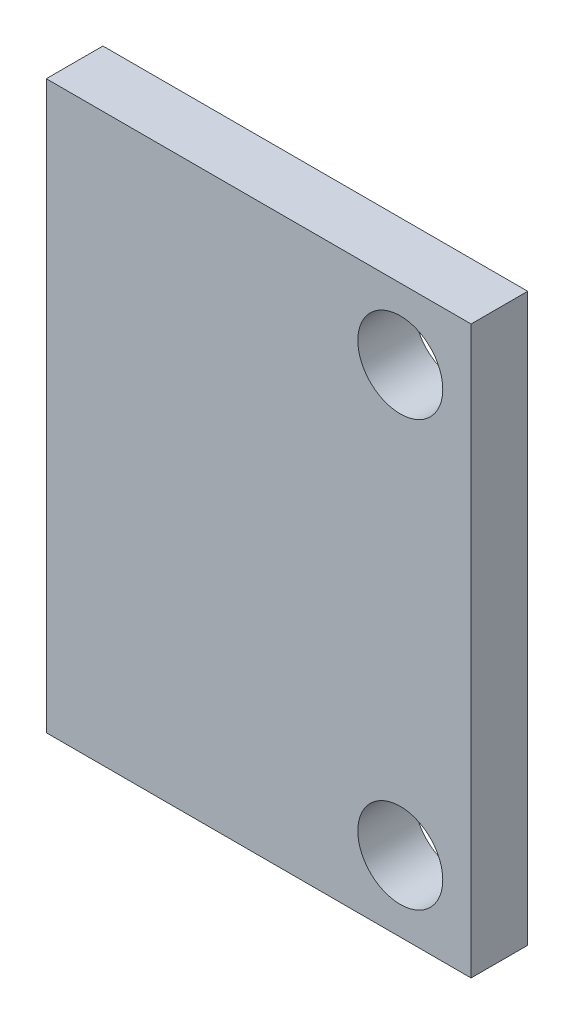
from build123d import *

# Parameters (mm, degrees)
SKETCH_1_W          = 15
SKETCH_1_H          = 20
EXTRUDE_1_DEPTH     = 2
SKETCH_2_R          = 1.5
CUT_EXTRUDE_1_DEPTH = 2


with BuildPart() as part:
    # ｽｹｯﾁ1 → ﾎﾞｽ - 押し出し1 (new body)
    with BuildSketch(Plane.XY):
        Rectangle(SKETCH_1_W, SKETCH_1_H)
    extrude(amount=EXTRUDE_1_DEPTH)

    # ｽｹｯﾁ2 → ｶｯﾄ - 押し出し1 (cut)
    with BuildSketch(Plane.XY.offset(2)):
        with Locations((5, 7.5)):
            Circle(SKETCH_2_R)
        with Locations((5, -7.5)):
            Circle(SKETCH_2_R)
    extrude(amount=-CUT_EXTRUDE_1_DEPTH, mode=Mode.SUBTRACT)


solid = part.part
